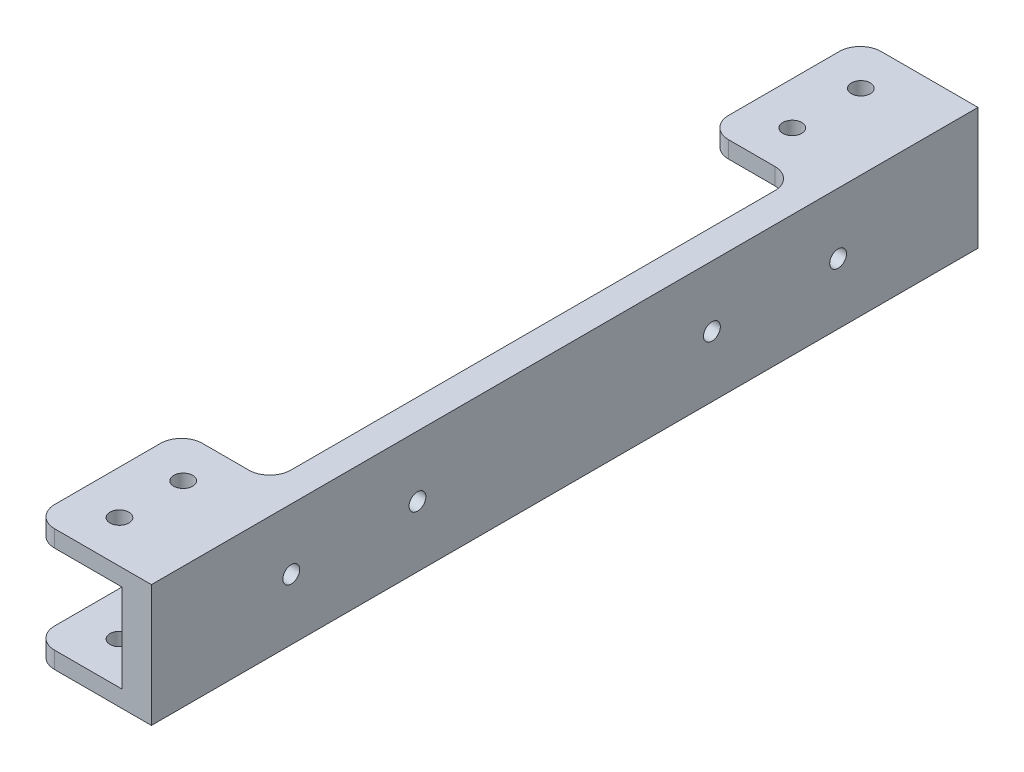
from build123d import *

# Parameters (mm, degrees)
BOSS_EXTRUDE1_DEPTH   = 29
FILLET1_R             = 5
CUT_EXTRUDE1_REACH    = 108.522
SKETCH3_W             = 196.5
SKETCH3_H             = 21
M4_CLEARANCE_HOLE1_D  = 4.5
F_4_0MM_DOWEL_HOLE1_D = 4


with BuildPart() as part:
    # Sketch2 → Boss-Extrude1 (new body)
    with BuildSketch(Plane(origin=(0, 0, 0), x_dir=(1, 0, 0), z_dir=(0, 1, 0))):
        Polygon((0, 97.9), (28, 97.9), (28, -98.6), (0, -98.6), (0, -63.45), (21, -63.45), (21, 61.6), (0, 61.6), align=None)
    extrude(amount=BOSS_EXTRUDE1_DEPTH)

    # Fillet1
    fillet1_edges = [part.edges().sort_by_distance(p)[0] for p in [
        (0, 14.5, -97.9),
        (0, 14.5, 98.6),
        (0, 14.5, 63.45),
        (21, 14.5, 63.45),
        (21, 14.5, -61.6),
        (0, 14.5, -61.6),
    ]]
    fillet(fillet1_edges, radius=FILLET1_R)

    # Cut-Extrude1: up to this face of the body (flat: up to its plane)
    cut_extrude1_end = Plane(part.part.faces().sort_by_distance((21, 14.5, 0.925))[0])
    # Sketch3 → Cut-Extrude1 (cut, up to the picked face)
    with BuildSketch(Plane.ZY, mode=Mode.PRIVATE) as cut_extrude1_sk1:
        with Locations((0.35, 14.5)):
            Rectangle(SKETCH3_W, SKETCH3_H)
    cut_extrude1_tool1 = split(extrude(cut_extrude1_sk1.sketch, amount=-CUT_EXTRUDE1_REACH, mode=Mode.PRIVATE), bisect_by=cut_extrude1_end, keep=Keep.BOTH, mode=Mode.PRIVATE)
    add(cut_extrude1_tool1.solids().sort_by(Axis((0, 14.5, 0.35), (1, 0, 0)))[0], mode=Mode.SUBTRACT)

    # M4 Clearance Hole1 (through all)
    with Locations(Plane(origin=(0, 0, 0), x_dir=(-1, 0, 0), z_dir=(0, -1, 0))):
        with Locations((-10.15, 87.9), (-10.15, 71.6), (-10.4, -73.45), (-10.4, -88.6)):
            Hole(M4_CLEARANCE_HOLE1_D / 2)

    # Ø4.0mm Dowel Hole1 (through all)
    with Locations(Plane.ZY.offset(-21)):
        with Locations((65.35, 14.5), (-34.65, 14.5), (-64.65, 14.5), (35.35, 14.5)):
            Hole(F_4_0MM_DOWEL_HOLE1_D / 2)


solid = part.part
